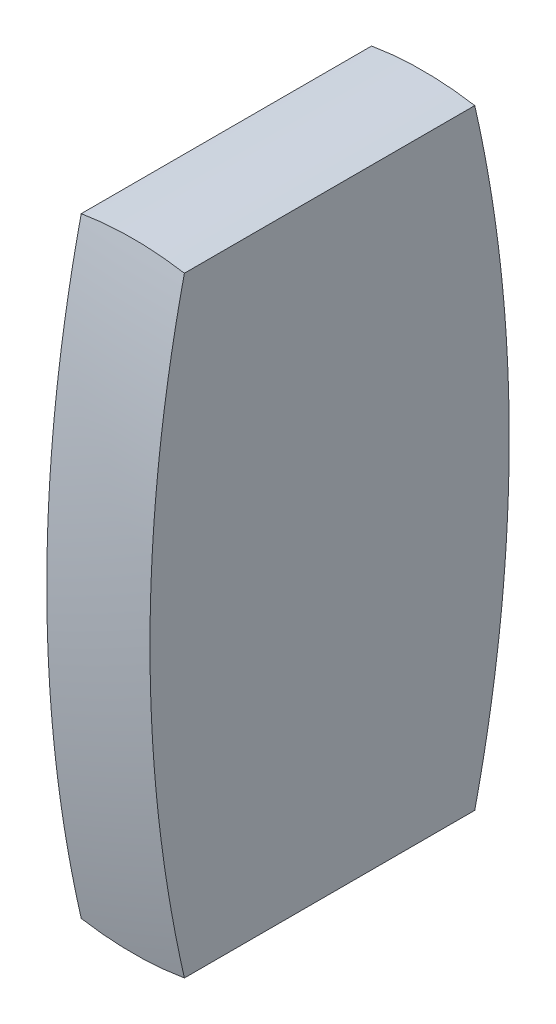
from build123d import *

# Parameters (mm, degrees)
BOSS_EXTRUDE1_DEPTH      = 10
BOSS_EXTRUDE1_DEPTH_BACK = 10
SKETCH1_R                = 3
CUT_EXTRUDE1_DEPTH       = 10
CUT_EXTRUDE1_DEPTH_BACK  = 10
SKETCH11_OUTSIDE_W       = 9.836
SKETCH11_OUTSIDE_H       = 9.836
SKETCH11_OUTSIDE_W_2     = 1
SKETCH11_OUTSIDE_H_2     = 6.690443666


with BuildPart() as part:
    # Sketch1 → Boss-Extrude1 (new, two sides: drawn at the far end of the back side and taken through both)
    with BuildSketch(Plane.XY.offset(-BOSS_EXTRUDE1_DEPTH_BACK)):
        Circle(SKETCH1_R)
    extrude(amount=BOSS_EXTRUDE1_DEPTH + BOSS_EXTRUDE1_DEPTH_BACK)

    # Sketch7 → Cut-Revolve5 (revolve, cut)
    with BuildSketch(Plane(origin=(0, 0, 0), x_dir=(1, 0, 0), z_dir=(0, 1, 0))):
        with BuildLine():
            Line((-5.350229687, -0.626413359), (-7.837029965, -11.630035865))
            Line((-7.837029965, -11.630035865), (0, -12.681735183))
            Line((0, -12.681735183), (0, -1.75))
            ThreePointArc((0, -1.75), (-2.733468705, -1.466072712), (-5.350229687, -0.626413359))
        make_face()
    revolve(axis=Axis((0, 0, -10), (0, 0, 1)), mode=Mode.SUBTRACT)

    # Sketch10 → Cut-Revolve6 (revolve, cut)
    with BuildSketch(Plane(origin=(0, 0, 0), x_dir=(1, 0, 0), z_dir=(0, 1, 0))):
        with BuildLine():
            Line((-9.335027104, -2.076496478), (-9.335027104, 13.220347749))
            Line((-9.335027104, 13.220347749), (0, 13.220347749))
            Line((0, 13.220347749), (0, 1.75))
            ThreePointArc((0, 1.75), (-5.044422819, 0.75625038), (-9.335027104, -2.076496478))
        make_face()
    revolve(axis=Axis((0, 0, -13.220347749), (0, 0, 1)), mode=Mode.SUBTRACT)

    # Sketch11 outside → Cut-Extrude1 (cut, two sides: drawn at the far end of the back side and taken through both)
    with BuildSketch(Plane.XY.offset(-CUT_EXTRUDE1_DEPTH_BACK)):
        Rectangle(SKETCH11_OUTSIDE_W, SKETCH11_OUTSIDE_H)
        Rectangle(SKETCH11_OUTSIDE_W_2, SKETCH11_OUTSIDE_H_2, mode=Mode.SUBTRACT)
    extrude(amount=CUT_EXTRUDE1_DEPTH + CUT_EXTRUDE1_DEPTH_BACK, mode=Mode.SUBTRACT)


solid = part.part
